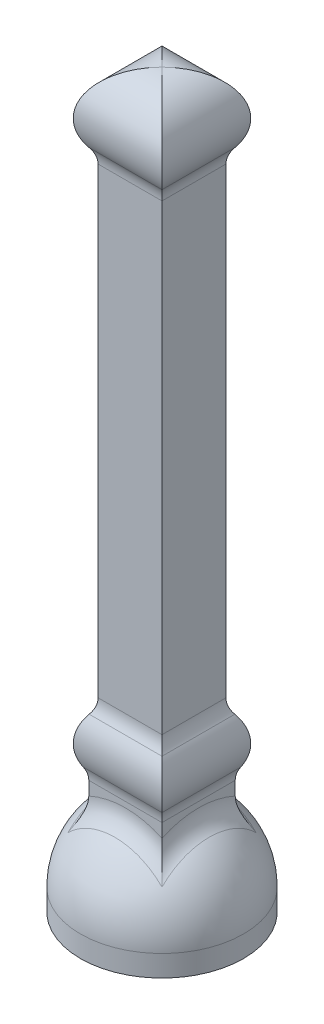
from build123d import *
from build123d.topology import SkipClean

# Parameters (mm, degrees)
SKETCH1_W           = 2.5
SKETCH1_H           = 2.5
BOSS_EXTRUDE1_DEPTH = 20
CUT_EXTRUDE1_DEPTH  = 21.077973005
CIRPATTERN1_COUNT   = 4
FILLET1_R           = 0.7
SKETCH6_R           = 2.29630994
BOSS_EXTRUDE2_DEPTH = 0.6


with BuildPart() as part:
    # Sketch1 → Boss-Extrude1 (new body)
    with BuildSketch(Plane(origin=(0, 0, 0), x_dir=(1, 0, 0), z_dir=(0, 1, 0))):
        Rectangle(SKETCH1_W, SKETCH1_H)
    extrude(amount=BOSS_EXTRUDE1_DEPTH)

    # Sketch3 → Cut-Extrude1 (cut, symmetric)
    with BuildSketch(Plane(origin=(0, 0, 0), x_dir=(0, 0, -1), z_dir=(1, 0, 0))):
        with BuildLine():
            Line((0, 20), (-2.286909141, 20))
            Line((-2.286909141, 20), (-2.286909141, 0))
            Line((-2.286909141, 0), (-1.031066268, 0))
            Line((-1.031066268, 0), (-1.031066268, 2.793315947))
            ThreePointArc((-1.031066268, 2.793315947), (-1.245689597, 3.603718018), (-0.9, 4.367467579))
            Line((-0.9, 4.367467579), (-0.9, 17.882532421))
            ThreePointArc((-0.9, 17.882532421), (-1.150398729, 19.238960902), (0, 20))
        make_face()
    cut_extrude1 = extrude(amount=CUT_EXTRUDE1_DEPTH, both=True, mode=Mode.SUBTRACT)

    # CirPattern1: Cut-Extrude1 ×4 about axis
    with SkipClean():  # the faces are left unmerged after this step: merging them gives an invalid solid
        cirpattern1_axis = Axis((0, 0, 0), (0, 1, 0))
        for i in range(1, CIRPATTERN1_COUNT):
            add(cut_extrude1.rotate(cirpattern1_axis, i * 360 / CIRPATTERN1_COUNT), mode=Mode.SUBTRACT)

    # Sketch2 → Revolve1 (revolve)
    with BuildSketch(Plane(origin=(0, 0, 0), x_dir=(0, 0, -1), z_dir=(1, 0, 0))):
        with BuildLine():
            Line((2.29630994, 0), (0, 0))
            Line((0, 0), (0, 2.29630994))
            ThreePointArc((0, 2.29630994), (1.623736331, 1.623736331), (2.29630994, 0))
        make_face()
    revolve(axis=Axis((0, 0, 0), (0, 1, 0)))

    # Fillet1
    fillet1_edges = [part.edges().sort_by_distance(p)[0] for p in [
        (0.9, 4.367467579, 0),
        (0, 4.367467579, -0.9),
        (-0.9, 4.367467579, 0),
        (0, 4.367467579, 0.9),
        (0, 17.882532421, -0.9),
        (-0.9, 17.882532421, 0),
        (0, 17.882532421, 0.9),
        (0.9, 17.882532421, 0),
        (-1.031066268, 2.793315947, 0),
        (0, 2.793315947, 1.031066268),
        (1.031066268, 2.793315947, 0),
        (0, 2.793315947, -1.031066268),
        (0.533927601, 1.981126702, -1.031066268),
        (-1.031066268, 2.051814244, 0),
        (0, 2.051814244, 1.031066268),
        (1.031066268, 2.051814244, 0),
    ]]
    fillet(fillet1_edges, radius=FILLET1_R)

    # Sketch6 → Boss-Extrude2 (add)
    with BuildSketch(Plane.XZ):
        with Locations(Location((0, 0, 0), (0, 0, 270))):
            Circle(SKETCH6_R)
    extrude(amount=BOSS_EXTRUDE2_DEPTH)


solid = part.part
